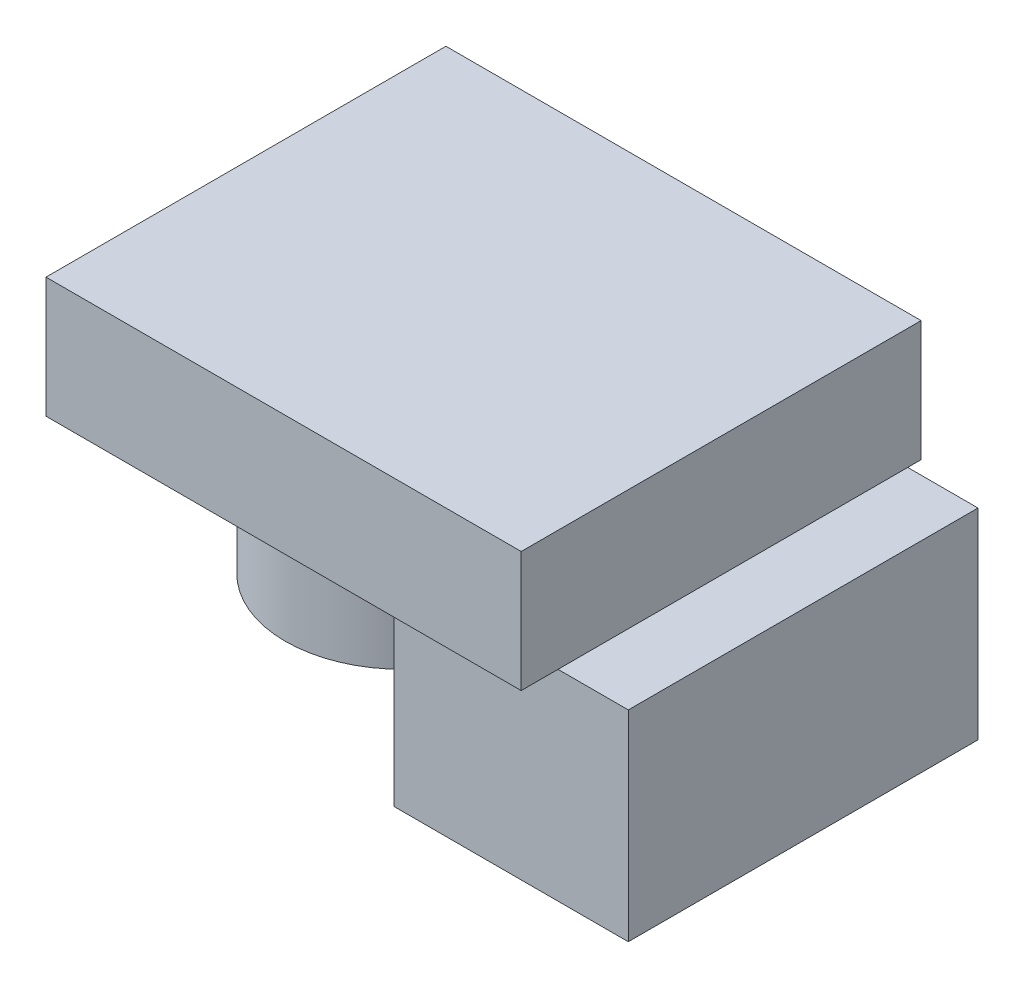
from build123d import *

# Parameters (mm, degrees)
SKETCH3_R           = 3.5
BOSS_EXTRUDE2_DEPTH = 5.5
SKETCH1_W           = 14.2
SKETCH1_H           = 11.95
BOSS_EXTRUDE3_DEPTH = 3.6
SKETCH4_W           = 7
SKETCH4_H           = 10.45
BOSS_EXTRUDE4_DEPTH = 6


with BuildPart() as part:
    # Sketch3 → Boss-Extrude2 (new body)
    with BuildSketch(Plane(origin=(0, 0, 0), x_dir=(1, 0, 0), z_dir=(0, 1, 0))):
        with Locations(Location((0, 0, 0), (0, 0, 270))):
            Circle(SKETCH3_R)
    extrude(amount=BOSS_EXTRUDE2_DEPTH)

    # Sketch1 → Boss-Extrude3 (add)
    with BuildSketch(Plane(origin=(0, 5.5, 0), x_dir=(1, 0, 0), z_dir=(0, 1, 0))):
        with Locations((3.2, -0.775)):
            Rectangle(SKETCH1_W, SKETCH1_H)
    extrude(amount=BOSS_EXTRUDE3_DEPTH)

    # Sketch4 → Boss-Extrude4 (add)
    with BuildSketch(Plane.XZ.offset(-5.5)):
        with Locations((8.9, 0.425)):
            Rectangle(SKETCH4_W, SKETCH4_H)
    extrude(amount=BOSS_EXTRUDE4_DEPTH)


solid = part.part
